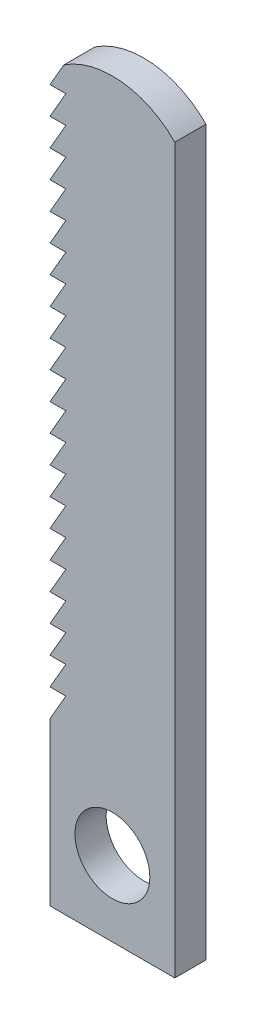
from build123d import *

# Parameters (mm, degrees)
ESQUISSE1_R                = 3
BASE_EXTRUSION_DEPTH       = 2.5
ENL_V_MAT_EXTRU_1_DEPTH    = 102.356317555
R_P_TITION_LIN_AIRE1_COUNT = 22
R_P_TITION_LIN_AIRE1_PITCH = 2.2


with BuildPart() as part:
    # Esquisse1 → Base-Extrusion (new body)
    with BuildSketch(Plane.XY):
        with BuildLine():
            Line((-5, 99.101020514), (-5, 41.101020514))
            Line((-5, 41.101020514), (5, 41.101020514))
            Line((5, 41.101020514), (5, 99.101020514))
            ThreePointArc((5, 99.101020514), (0, 101.202041029), (-5, 99.101020514))
        make_face()
        with Locations((0, 47.101020514)):
            Circle(ESQUISSE1_R, mode=Mode.SUBTRACT)
    extrude(amount=BASE_EXTRUSION_DEPTH)

    # Esquisse2 → Enlèv. mat.-Extru.1 (cut, through all)
    with BuildSketch(Plane.XY.offset(2.5)):
        Polygon((-5, 56.301020514), (-5, 54.101020514), (-3.729829408, 56.301020514), align=None)
    enl_v_mat_extru_1 = extrude(amount=-ENL_V_MAT_EXTRU_1_DEPTH, mode=Mode.SUBTRACT)

    # Répétition linéaire1: Enlèv. mat.-Extru.1 ×22
    with Locations(*[(0, i * R_P_TITION_LIN_AIRE1_PITCH, 0) for i in range(1, R_P_TITION_LIN_AIRE1_COUNT)]):
        add(enl_v_mat_extru_1, mode=Mode.SUBTRACT)


solid = part.part
